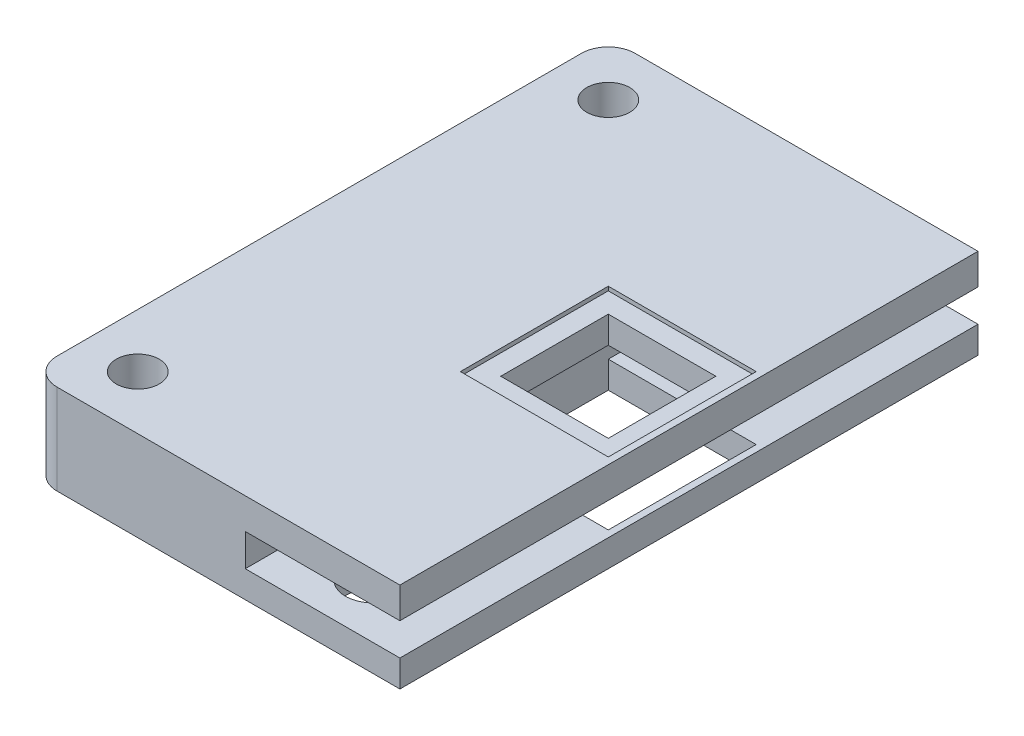
from build123d import *

# Parameters (mm, degrees)
SKETCH1_W                          = 21.5
SKETCH1_H                          = 21.5
BOSS_EXTRUDE1_DEPTH                = 3.2
SKETCH2_W                          = 5.5
SKETCH2_H                          = 1.2
CUT_EXTRUDE1_DEPTH                 = 27.231822721
SKETCH3_W                          = 21.5
SKETCH3_H                          = 21.5
SKETCH3_W_2                        = 5.5
SKETCH3_H_2                        = 5.5
BOSS_EXTRUDE2_DEPTH                = 0.15
SKETCH11_W                         = 4
SKETCH11_H                         = 4
CUT_EXTRUDE2_DEPTH                 = 19.869717175
TAP_DRILL_FOR_M2X0_4_TAP3_D        = 1.6
TAP_DRILL_FOR_M2_5X0_45_TAP1_D     = 2.05
TAP_DRILL_FOR_M2_5X0_45_TAP1_DEPTH = 1
CUT_EXTRUDE3_REACH                 = 20.896
SKETCH18_W                         = 5.5
SKETCH18_H                         = 5.5
FILLET3_R                          = 1
SKETCH21_W                         = 13.124555245
SKETCH21_H                         = 35.298127434
CUT_EXTRUDE8_DEPTH                 = 19.895733017
SKETCH22_W                         = 0.25
SKETCH22_H                         = 1.2
CUT_EXTRUDE9_DEPTH                 = 27.250543295


with BuildPart() as part:
    # Sketch1 → Boss-Extrude1 (new body)
    with BuildSketch(Plane(origin=(0, 0, 0), x_dir=(1, 0, 0), z_dir=(0, 1, 0))):
        with Locations((-3.933954619, -0.660858995)):
            Rectangle(SKETCH1_W, SKETCH1_H)
    extrude(amount=BOSS_EXTRUDE1_DEPTH)

    # Sketch2 → Cut-Extrude1 (cut, through all)
    with BuildSketch(Plane.XY.offset(11.410858995)):
        with Locations((-3.933954619, 1.6)):
            Rectangle(SKETCH2_W, SKETCH2_H)
    extrude(amount=-CUT_EXTRUDE1_DEPTH, mode=Mode.SUBTRACT)

    # Sketch3 → Boss-Extrude2 (add)
    with BuildSketch(Plane(origin=(0, 3.2, 0), x_dir=(1, 0, 0), z_dir=(0, 1, 0))):
        with Locations((-3.933954619, -0.660858995)):
            Rectangle(SKETCH3_W, SKETCH3_H)
        with Locations((-3.933954619, -0.660858995)):
            Rectangle(SKETCH3_W_2, SKETCH3_H_2, mode=Mode.SUBTRACT)
    extrude(amount=BOSS_EXTRUDE2_DEPTH)

    # Sketch11 → Cut-Extrude2 (cut, through all)
    with BuildSketch(Plane(origin=(0, 3.2, 0), x_dir=(1, 0, 0), z_dir=(0, 1, 0))):
        with Locations((-3.933954619, -0.660858995)):
            Rectangle(SKETCH11_W, SKETCH11_H)
    extrude(amount=-CUT_EXTRUDE2_DEPTH, mode=Mode.SUBTRACT)

    # Tap Drill for M2x0.4 Tap3 (through all)
    with Locations(Plane(origin=(0, 3.35, 0), x_dir=(1, 0, 0), z_dir=(0, 1, 0))):
        with Locations((-12.683954619, 8.089141005), (4.816045381, 8.089141005), (4.816045381, -9.410858995), (-12.683954619, -9.410858995)):
            Hole(TAP_DRILL_FOR_M2X0_4_TAP3_D / 2)

    # Tap Drill for M2.5x0.45 Tap1
    with Locations(Plane(origin=(0, 0, 0), x_dir=(-1, 0, 0), z_dir=(0, -1, 0))):
        with Locations((3.933954619, 8.089141005), (3.933954619, -9.410858995), (3.933954619, 4.539141005), (3.933954619, -5.860858995)):
            Hole(TAP_DRILL_FOR_M2_5X0_45_TAP1_D / 2, depth=TAP_DRILL_FOR_M2_5X0_45_TAP1_DEPTH)

    # Sketch18 → Cut-Extrude3 (cut, up to next)
    with BuildSketch(Plane.XZ, mode=Mode.PRIVATE) as cut_extrude3_sk1:
        with Locations((-3.933954619, 0.660858995)):
            Rectangle(SKETCH18_W, SKETCH18_H)
    cut_extrude3_tool1 = extrude(cut_extrude3_sk1.sketch, amount=-CUT_EXTRUDE3_REACH, mode=Mode.PRIVATE) & part.part
    add(cut_extrude3_tool1.solids().sort_by_distance((-3.933955, 0, 0.660859))[0], mode=Mode.SUBTRACT)

    # Fillet3
    fillet3_edges = [part.edges().sort_by_distance(p)[0] for p in [
        (-14.683954619, 1.675, -10.089141005),
        (6.816045381, 1.675, -10.089141005),
        (6.816045381, 1.675, 11.410858995),
        (-14.683954619, 1.675, 11.410858995),
    ]]
    fillet(fillet3_edges, radius=FILLET3_R)

    # Sketch21 → Cut-Extrude8 (cut, through all)
    with BuildSketch(Plane(origin=(0, 3.35, 0), x_dir=(1, 0, 0), z_dir=(0, 1, 0))):
        with Locations((5.628323004, -1.911462044)):
            Rectangle(SKETCH21_W, SKETCH21_H)
    extrude(amount=-CUT_EXTRUDE8_DEPTH, mode=Mode.SUBTRACT)

    # Sketch22 → Cut-Extrude9 (cut, through all)
    with BuildSketch(Plane(origin=(0, 0, -10.089141005), x_dir=(-1, 0, 0), z_dir=(0, 0, -1))):
        with Locations((1.058954619, 1.6)):
            Rectangle(SKETCH22_W, SKETCH22_H)
    extrude(amount=-CUT_EXTRUDE9_DEPTH, mode=Mode.SUBTRACT)


solid = part.part
